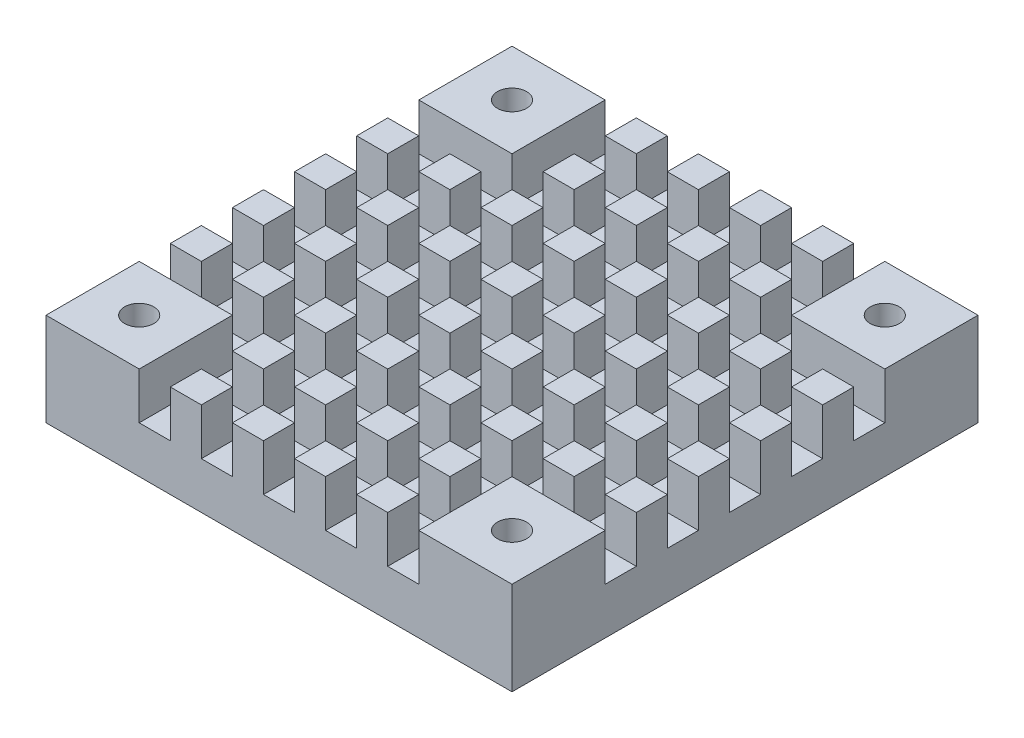
from build123d import *

# Parameters (mm, degrees)
SKETCH_2_W      = 40
SKETCH_2_H      = 40
SKETCH_2_R      = 1.25
EXTRUDE_1_DEPTH = 4
SKETCH_3_W      = 2.666666666
SKETCH_3_H      = 2.666666667
SKETCH_3_W_2    = 8
SKETCH_3_H_2    = 8
SKETCH_3_R      = 1.25
SKETCH_3_W_3    = 2.666666667
SKETCH_3_H_3    = 2.666666666
EXTRUDE_2_DEPTH = 4


with BuildPart() as part:
    # 草图2 → 凸台-拉伸1 (new body)
    with BuildSketch(Plane(origin=(0, 0, 0), x_dir=(1, 0, 0), z_dir=(0, 1, 0))):
        Rectangle(SKETCH_2_W, SKETCH_2_H)
        with Locations(Location((-16, 16, 0), (0, 0, 270))):
            Circle(SKETCH_2_R, mode=Mode.SUBTRACT)
        with Locations(Location((16, 16, 0), (0, 0, 270))):
            Circle(SKETCH_2_R, mode=Mode.SUBTRACT)
        with Locations(Location((16, -16, 0), (0, 0, 270))):
            Circle(SKETCH_2_R, mode=Mode.SUBTRACT)
        with Locations(Location((-16, -16, 0), (0, 0, 270))):
            Circle(SKETCH_2_R, mode=Mode.SUBTRACT)
    extrude(amount=EXTRUDE_1_DEPTH)

    # 草图3 → 凸台-拉伸2 (add)
    # profile 1 of 52: a face of its own
    with BuildSketch(Plane(origin=(0, 4, 0), x_dir=(1, 0, 0), z_dir=(0, 1, 0))):
        with Locations((8, -13.333333334)):
            Rectangle(SKETCH_3_W, SKETCH_3_H)
    # profile 2 of 52: a face of its own
    with BuildSketch(Plane(origin=(0, 4, 0), x_dir=(1, 0, 0), z_dir=(0, 1, 0))):
        with Locations((16, -16)):
            Rectangle(SKETCH_3_W_2, SKETCH_3_H_2)
        with Locations(Location((16, -16, 0), (0, 0, 270))):
            Circle(SKETCH_3_R, mode=Mode.SUBTRACT)
    # profile 3 of 52: a face of its own
    with BuildSketch(Plane(origin=(0, 4, 0), x_dir=(1, 0, 0), z_dir=(0, 1, 0))):
        with Locations((16, 16)):
            Rectangle(SKETCH_3_W_2, SKETCH_3_H_2)
        with Locations(Location((16, 16, 0), (0, 0, 270))):
            Circle(SKETCH_3_R, mode=Mode.SUBTRACT)
    # profile 4 of 52: a face of its own
    with BuildSketch(Plane(origin=(0, 4, 0), x_dir=(1, 0, 0), z_dir=(0, 1, 0))):
        with Locations((-16, 16)):
            Rectangle(SKETCH_3_W_2, SKETCH_3_H_2)
        with Locations(Location((-16, 16, 0), (0, 0, 270))):
            Circle(SKETCH_3_R, mode=Mode.SUBTRACT)
    # profile 5 of 52: a face of its own
    with BuildSketch(Plane(origin=(0, 4, 0), x_dir=(1, 0, 0), z_dir=(0, 1, 0))):
        with Locations((-16, -16)):
            Rectangle(SKETCH_3_W_2, SKETCH_3_H_2)
        with Locations(Location((-16, -16, 0), (0, 0, 270))):
            Circle(SKETCH_3_R, mode=Mode.SUBTRACT)
    # profile 6 of 52: a face of its own
    with BuildSketch(Plane(origin=(0, 4, 0), x_dir=(1, 0, 0), z_dir=(0, 1, 0))):
        with Locations((18.666666666, 8)):
            Rectangle(SKETCH_3_W_3, SKETCH_3_H_3)
    # profile 7 of 52: a face of its own
    with BuildSketch(Plane(origin=(0, 4, 0), x_dir=(1, 0, 0), z_dir=(0, 1, 0))):
        with Locations((18.666666666, 2.666666667)):
            Rectangle(SKETCH_3_W_3, SKETCH_3_H)
    # profile 8 of 52: a face of its own
    with BuildSketch(Plane(origin=(0, 4, 0), x_dir=(1, 0, 0), z_dir=(0, 1, 0))):
        with Locations((18.666666666, -2.666666667)):
            Rectangle(SKETCH_3_W_3, SKETCH_3_H)
    # profile 9 of 52: a face of its own
    with BuildSketch(Plane(origin=(0, 4, 0), x_dir=(1, 0, 0), z_dir=(0, 1, 0))):
        with Locations((18.666666666, -8)):
            Rectangle(SKETCH_3_W_3, SKETCH_3_H_3)
    # profile 10 of 52: a face of its own
    with BuildSketch(Plane(origin=(0, 4, 0), x_dir=(1, 0, 0), z_dir=(0, 1, 0))):
        with Locations((-13.333333334, 8)):
            Rectangle(SKETCH_3_W_3, SKETCH_3_H_3)
    # profile 11 of 52: a face of its own
    with BuildSketch(Plane(origin=(0, 4, 0), x_dir=(1, 0, 0), z_dir=(0, 1, 0))):
        with Locations((-8, 18.666666666)):
            Rectangle(SKETCH_3_W, SKETCH_3_H)
    # profile 12 of 52: a face of its own
    with BuildSketch(Plane(origin=(0, 4, 0), x_dir=(1, 0, 0), z_dir=(0, 1, 0))):
        with Locations((-18.666666666, 2.666666667)):
            Rectangle(SKETCH_3_W_3, SKETCH_3_H)
    # profile 13 of 52: a face of its own
    with BuildSketch(Plane(origin=(0, 4, 0), x_dir=(1, 0, 0), z_dir=(0, 1, 0))):
        with Locations((-2.666666667, 18.666666666)):
            Rectangle(SKETCH_3_W_3, SKETCH_3_H)
    # profile 14 of 52: a face of its own
    with BuildSketch(Plane(origin=(0, 4, 0), x_dir=(1, 0, 0), z_dir=(0, 1, 0))):
        with Locations((2.666666667, 18.666666666)):
            Rectangle(SKETCH_3_W_3, SKETCH_3_H)
    # profile 15 of 52: a face of its own
    with BuildSketch(Plane(origin=(0, 4, 0), x_dir=(1, 0, 0), z_dir=(0, 1, 0))):
        with Locations((8, 18.666666666)):
            Rectangle(SKETCH_3_W, SKETCH_3_H)
    # profile 16 of 52: a face of its own
    with BuildSketch(Plane(origin=(0, 4, 0), x_dir=(1, 0, 0), z_dir=(0, 1, 0))):
        with Locations((-13.333333334, 2.666666667)):
            Rectangle(SKETCH_3_W_3, SKETCH_3_H)
    # profile 17 of 52: a face of its own
    with BuildSketch(Plane(origin=(0, 4, 0), x_dir=(1, 0, 0), z_dir=(0, 1, 0))):
        with Locations((8, -18.666666666)):
            Rectangle(SKETCH_3_W, SKETCH_3_H)
    # profile 18 of 52: a face of its own
    with BuildSketch(Plane(origin=(0, 4, 0), x_dir=(1, 0, 0), z_dir=(0, 1, 0))):
        with Locations((-18.666666666, 8)):
            Rectangle(SKETCH_3_W_3, SKETCH_3_H_3)
    # profile 19 of 52: a face of its own
    with BuildSketch(Plane(origin=(0, 4, 0), x_dir=(1, 0, 0), z_dir=(0, 1, 0))):
        with Locations((8, 13.333333334)):
            Rectangle(SKETCH_3_W, SKETCH_3_H)
    # profile 20 of 52: a face of its own
    with BuildSketch(Plane(origin=(0, 4, 0), x_dir=(1, 0, 0), z_dir=(0, 1, 0))):
        with Locations((13.333333334, 8)):
            Rectangle(SKETCH_3_W_3, SKETCH_3_H_3)
    # profile 21 of 52: a face of its own
    with BuildSketch(Plane(origin=(0, 4, 0), x_dir=(1, 0, 0), z_dir=(0, 1, 0))):
        with Locations((-13.333333334, -2.666666667)):
            Rectangle(SKETCH_3_W_3, SKETCH_3_H)
    # profile 22 of 52: a face of its own
    with BuildSketch(Plane(origin=(0, 4, 0), x_dir=(1, 0, 0), z_dir=(0, 1, 0))):
        with Locations((-13.333333334, -8)):
            Rectangle(SKETCH_3_W_3, SKETCH_3_H_3)
    # profile 23 of 52: a face of its own
    with BuildSketch(Plane(origin=(0, 4, 0), x_dir=(1, 0, 0), z_dir=(0, 1, 0))):
        with Locations((-8, -18.666666666)):
            Rectangle(SKETCH_3_W, SKETCH_3_H)
    # profile 24 of 52: a face of its own
    with BuildSketch(Plane(origin=(0, 4, 0), x_dir=(1, 0, 0), z_dir=(0, 1, 0))):
        with Locations((-8, -13.333333334)):
            Rectangle(SKETCH_3_W, SKETCH_3_H)
    # profile 25 of 52: a face of its own
    with BuildSketch(Plane(origin=(0, 4, 0), x_dir=(1, 0, 0), z_dir=(0, 1, 0))):
        with Locations((-2.666666667, -13.333333334)):
            Rectangle(SKETCH_3_W_3, SKETCH_3_H)
    # profile 26 of 52: a face of its own
    with BuildSketch(Plane(origin=(0, 4, 0), x_dir=(1, 0, 0), z_dir=(0, 1, 0))):
        with Locations((2.666666667, -13.333333334)):
            Rectangle(SKETCH_3_W_3, SKETCH_3_H)
    # profile 27 of 52: a face of its own
    with BuildSketch(Plane(origin=(0, 4, 0), x_dir=(1, 0, 0), z_dir=(0, 1, 0))):
        with Locations((8, 8)):
            Rectangle(SKETCH_3_W, SKETCH_3_H_3)
    # profile 28 of 52: a face of its own
    with BuildSketch(Plane(origin=(0, 4, 0), x_dir=(1, 0, 0), z_dir=(0, 1, 0))):
        with Locations((8, 2.666666667)):
            Rectangle(SKETCH_3_W, SKETCH_3_H)
    # profile 29 of 52: a face of its own
    with BuildSketch(Plane(origin=(0, 4, 0), x_dir=(1, 0, 0), z_dir=(0, 1, 0))):
        with Locations((8, -2.666666667)):
            Rectangle(SKETCH_3_W, SKETCH_3_H)
    # profile 30 of 52: a face of its own
    with BuildSketch(Plane(origin=(0, 4, 0), x_dir=(1, 0, 0), z_dir=(0, 1, 0))):
        with Locations((8, -8)):
            Rectangle(SKETCH_3_W, SKETCH_3_H_3)
    # profile 31 of 52: a face of its own
    with BuildSketch(Plane(origin=(0, 4, 0), x_dir=(1, 0, 0), z_dir=(0, 1, 0))):
        with Locations((-8, 8)):
            Rectangle(SKETCH_3_W, SKETCH_3_H_3)
    # profile 32 of 52: a face of its own
    with BuildSketch(Plane(origin=(0, 4, 0), x_dir=(1, 0, 0), z_dir=(0, 1, 0))):
        with Locations((-2.666666667, 8)):
            Rectangle(SKETCH_3_W_3, SKETCH_3_H_3)
    # profile 33 of 52: a face of its own
    with BuildSketch(Plane(origin=(0, 4, 0), x_dir=(1, 0, 0), z_dir=(0, 1, 0))):
        with Locations((2.666666667, 8)):
            Rectangle(SKETCH_3_W_3, SKETCH_3_H_3)
    # profile 34 of 52: a face of its own
    with BuildSketch(Plane(origin=(0, 4, 0), x_dir=(1, 0, 0), z_dir=(0, 1, 0))):
        with Locations((-8, 2.666666667)):
            Rectangle(SKETCH_3_W, SKETCH_3_H)
    # profile 35 of 52: a face of its own
    with BuildSketch(Plane(origin=(0, 4, 0), x_dir=(1, 0, 0), z_dir=(0, 1, 0))):
        with Locations((-2.666666667, 2.666666667)):
            Rectangle(SKETCH_3_W_3, SKETCH_3_H)
    # profile 36 of 52: a face of its own
    with BuildSketch(Plane(origin=(0, 4, 0), x_dir=(1, 0, 0), z_dir=(0, 1, 0))):
        with Locations((2.666666667, 2.666666667)):
            Rectangle(SKETCH_3_W_3, SKETCH_3_H)
    # profile 37 of 52: a face of its own
    with BuildSketch(Plane(origin=(0, 4, 0), x_dir=(1, 0, 0), z_dir=(0, 1, 0))):
        with Locations((13.333333334, 2.666666667)):
            Rectangle(SKETCH_3_W_3, SKETCH_3_H)
    # profile 38 of 52: a face of its own
    with BuildSketch(Plane(origin=(0, 4, 0), x_dir=(1, 0, 0), z_dir=(0, 1, 0))):
        with Locations((-18.666666666, -2.666666667)):
            Rectangle(SKETCH_3_W_3, SKETCH_3_H)
    # profile 39 of 52: a face of its own
    with BuildSketch(Plane(origin=(0, 4, 0), x_dir=(1, 0, 0), z_dir=(0, 1, 0))):
        with Locations((-8, -2.666666667)):
            Rectangle(SKETCH_3_W, SKETCH_3_H)
    # profile 40 of 52: a face of its own
    with BuildSketch(Plane(origin=(0, 4, 0), x_dir=(1, 0, 0), z_dir=(0, 1, 0))):
        with Locations((-2.666666667, -2.666666667)):
            Rectangle(SKETCH_3_W_3, SKETCH_3_H)
    # profile 41 of 52: a face of its own
    with BuildSketch(Plane(origin=(0, 4, 0), x_dir=(1, 0, 0), z_dir=(0, 1, 0))):
        with Locations((2.666666667, -2.666666667)):
            Rectangle(SKETCH_3_W_3, SKETCH_3_H)
    # profile 42 of 52: a face of its own
    with BuildSketch(Plane(origin=(0, 4, 0), x_dir=(1, 0, 0), z_dir=(0, 1, 0))):
        with Locations((13.333333334, -2.666666667)):
            Rectangle(SKETCH_3_W_3, SKETCH_3_H)
    # profile 43 of 52: a face of its own
    with BuildSketch(Plane(origin=(0, 4, 0), x_dir=(1, 0, 0), z_dir=(0, 1, 0))):
        with Locations((-18.666666666, -8)):
            Rectangle(SKETCH_3_W_3, SKETCH_3_H_3)
    # profile 44 of 52: a face of its own
    with BuildSketch(Plane(origin=(0, 4, 0), x_dir=(1, 0, 0), z_dir=(0, 1, 0))):
        with Locations((-8, -8)):
            Rectangle(SKETCH_3_W, SKETCH_3_H_3)
    # profile 45 of 52: a face of its own
    with BuildSketch(Plane(origin=(0, 4, 0), x_dir=(1, 0, 0), z_dir=(0, 1, 0))):
        with Locations((-2.666666667, -8)):
            Rectangle(SKETCH_3_W_3, SKETCH_3_H_3)
    # profile 46 of 52: a face of its own
    with BuildSketch(Plane(origin=(0, 4, 0), x_dir=(1, 0, 0), z_dir=(0, 1, 0))):
        with Locations((2.666666667, -8)):
            Rectangle(SKETCH_3_W_3, SKETCH_3_H_3)
    # profile 47 of 52: a face of its own
    with BuildSketch(Plane(origin=(0, 4, 0), x_dir=(1, 0, 0), z_dir=(0, 1, 0))):
        with Locations((13.333333334, -8)):
            Rectangle(SKETCH_3_W_3, SKETCH_3_H_3)
    # profile 48 of 52: a face of its own
    with BuildSketch(Plane(origin=(0, 4, 0), x_dir=(1, 0, 0), z_dir=(0, 1, 0))):
        with Locations((-8, 13.333333334)):
            Rectangle(SKETCH_3_W, SKETCH_3_H)
    # profile 49 of 52: a face of its own
    with BuildSketch(Plane(origin=(0, 4, 0), x_dir=(1, 0, 0), z_dir=(0, 1, 0))):
        with Locations((-2.666666667, -18.666666666)):
            Rectangle(SKETCH_3_W_3, SKETCH_3_H)
    # profile 50 of 52: a face of its own
    with BuildSketch(Plane(origin=(0, 4, 0), x_dir=(1, 0, 0), z_dir=(0, 1, 0))):
        with Locations((-2.666666667, 13.333333334)):
            Rectangle(SKETCH_3_W_3, SKETCH_3_H)
    # profile 51 of 52: a face of its own
    with BuildSketch(Plane(origin=(0, 4, 0), x_dir=(1, 0, 0), z_dir=(0, 1, 0))):
        with Locations((2.666666667, -18.666666666)):
            Rectangle(SKETCH_3_W_3, SKETCH_3_H)
    # profile 52 of 52: a face of its own
    with BuildSketch(Plane(origin=(0, 4, 0), x_dir=(1, 0, 0), z_dir=(0, 1, 0))):
        with Locations((2.666666667, 13.333333334)):
            Rectangle(SKETCH_3_W_3, SKETCH_3_H)
    extrude(amount=EXTRUDE_2_DEPTH)


solid = part.part
